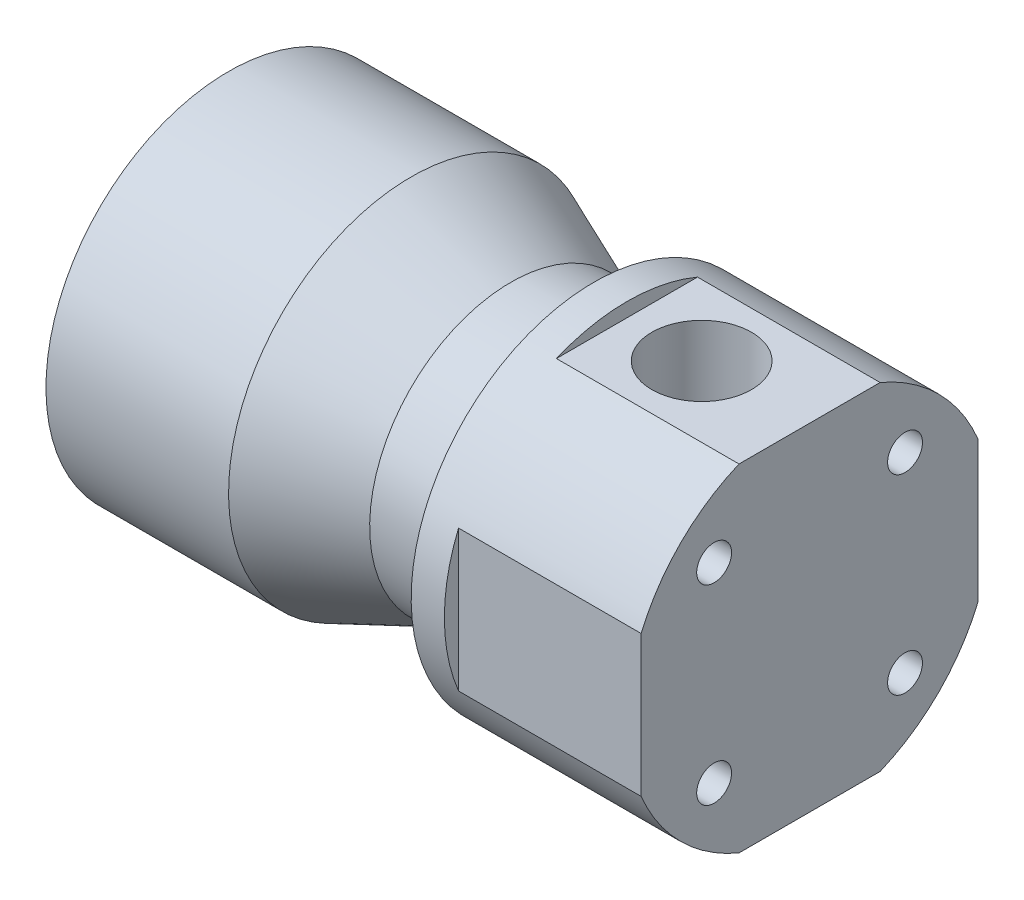
from build123d import *

# Parameters (mm, degrees)
CUT_EXTRUDE1_START = -22
SKETCH2_R          = 2.1
CUT_EXTRUDE1_DEPTH = 22
CUT_EXTRUDE2_REACH = 86.691
SKETCH3_R          = 6


with BuildPart() as part:
    # Sketch1 → Revolve1 (revolve)
    with BuildSketch(Plane(origin=(0, 0, 0), x_dir=(0, 1, 0), z_dir=(0, 0, 1)), mode=Mode.PRIVATE) as revolve1_sk:
        Polygon((0, 0), (22, 0), (22, 26), (17, 26), (17, 36), (22, 48), (22, 70), (0, 70), align=None)
    revolve(revolve1_sk.sketch.rotate(Axis((-70, 0, 0), (1, 0, 0)), 180), axis=Axis((-70, 0, 0), (1, 0, 0)))

    # Sketch2 → Cut-Extrude1 (cut)
    with BuildSketch(Plane.YZ.offset(CUT_EXTRUDE1_START)):
        with Locations(Location((-11.5, 11.5, 0), (0, 0, 270))):
            Circle(SKETCH2_R)
        with Locations(Location((11.5, 11.5, 0), (0, 0, 270))):
            Circle(SKETCH2_R)
        with Locations(Location((11.5, -11.5, 0), (0, 0, 270))):
            Circle(SKETCH2_R)
        with Locations(Location((-11.5, -11.5, 0), (0, 0, 270))):
            Circle(SKETCH2_R)
        with BuildLine():
            Line((-8.5, 20.291623888), (8.5, 20.291623888))
            ThreePointArc((8.5, 20.291623888), (0, 22), (-8.5, 20.291623888))
        make_face()
        with BuildLine():
            Line((20.291623888, 8.5), (20.291623888, -8.5))
            ThreePointArc((20.291623888, -8.5), (22, 0), (20.291623888, 8.5))
        make_face()
        with BuildLine():
            Line((8.5, -20.291623888), (-8.5, -20.291623888))
            ThreePointArc((-8.5, -20.291623888), (0, -22), (8.5, -20.291623888))
        make_face()
        with BuildLine():
            Line((-20.291623888, -8.5), (-20.291623888, 8.5))
            ThreePointArc((-20.291623888, 8.5), (-22, 0), (-20.291623888, -8.5))
        make_face()
    extrude(amount=CUT_EXTRUDE1_DEPTH, mode=Mode.SUBTRACT)

    # Sketch3 → Cut-Extrude2 (cut, up to next)
    with BuildSketch(Plane(origin=(0, 20.291623888, 0), x_dir=(-1, 0, 0), z_dir=(0, 1, 0)), mode=Mode.PRIVATE) as cut_extrude2_sk1:
        with Locations(Location((13, 0, 0), (0, 0, 90))):
            Circle(SKETCH3_R)
    cut_extrude2_tool1 = extrude(cut_extrude2_sk1.sketch, amount=-CUT_EXTRUDE2_REACH, mode=Mode.PRIVATE) & part.part
    add(cut_extrude2_tool1.solids().sort_by_distance((-13, 20.291624, 0))[0], mode=Mode.SUBTRACT)


solid = part.part
